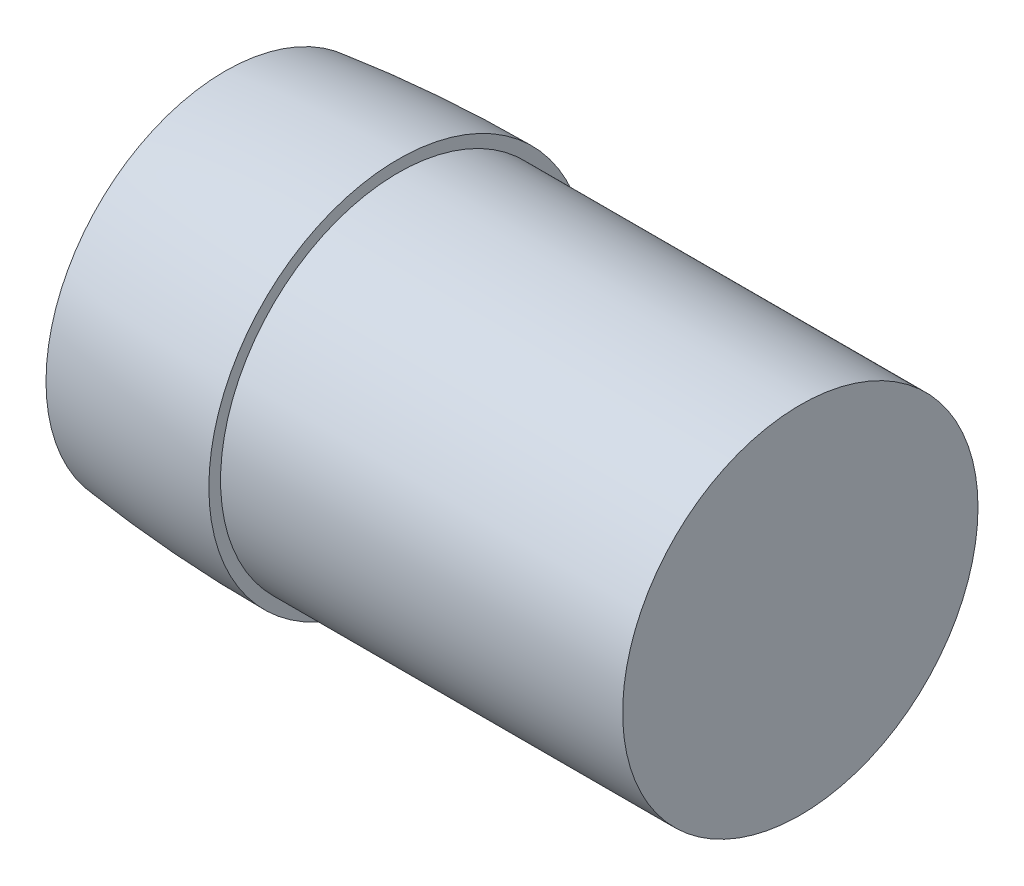
from build123d import *


with BuildPart() as part:
    # Sketch1 → Revolve1 (revolve)
    with BuildSketch(Plane.XY, mode=Mode.PRIVATE) as revolve1_sk:
        with BuildLine():
            Line((0, 316.674418605), (0, 314.174418605))
            Line((0, 314.174418605), (86, 314.174418605))
            Line((86, 314.174418605), (86, 276.174418605))
            Line((86, 276.174418605), (81, 276.174418605))
            Line((81, 276.174418605), (81, 309.174418605))
            Line((81, 309.174418605), (-5, 309.174418605))
            Line((-5, 309.174418605), (-5, 314.134629268))
            ThreePointArc((-5, 314.134629268), (-21.02740861, 313.469956125), (-37, 311.988085198))
            Line((-37, 311.988085198), (-37, 314.505464815))
            ThreePointArc((-37, 314.505464815), (-18.53175896, 316.131715126), (0, 316.674418605))
        make_face()
    revolve(revolve1_sk.sketch.rotate(Axis((86, 276.174418605, 0), (-1, 0, 0)), 90), axis=Axis((86, 276.174418605, 0), (-1, 0, 0)))


solid = part.part
